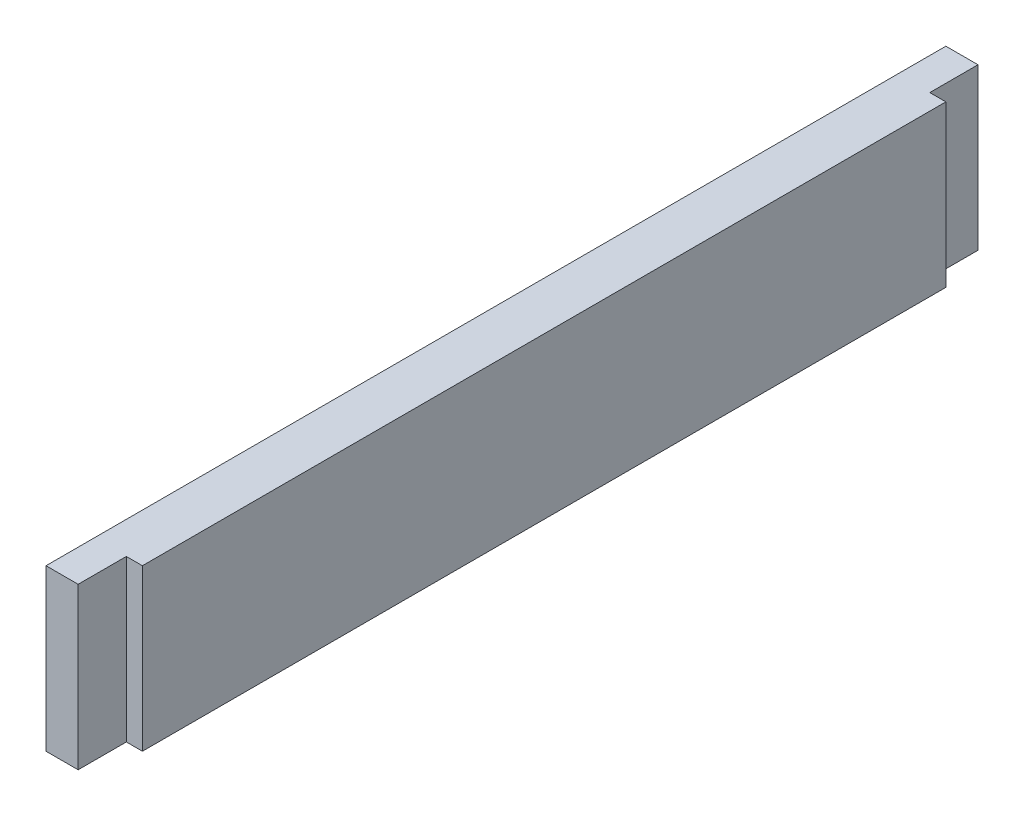
from build123d import *

# Parameters (mm, degrees)
BOSS_EXTRUDE1_DEPTH      = 15.875
BOSS_EXTRUDE1_DEPTH_BACK = 15.875


with BuildPart() as part:
    # Sketch2 → Boss-Extrude1 (new, two sides: drawn at the far end of the back side and taken through both)
    with BuildSketch(Plane(origin=(0, 0, 0), x_dir=(1, 0, 0), z_dir=(0, 1, 0)).offset(-BOSS_EXTRUDE1_DEPTH_BACK)):
        Polygon((-171.45, 88.9), (-171.45, -88.9), (-165.1, -88.9), (-165.1, -79.375), (-161.925, -79.375), (-161.925, 25.4), (-161.925, 34.925), (-161.925, 79.375), (-165.1, 79.375), (-165.1, 88.9), align=None)
    extrude(amount=BOSS_EXTRUDE1_DEPTH + BOSS_EXTRUDE1_DEPTH_BACK)


solid = part.part
